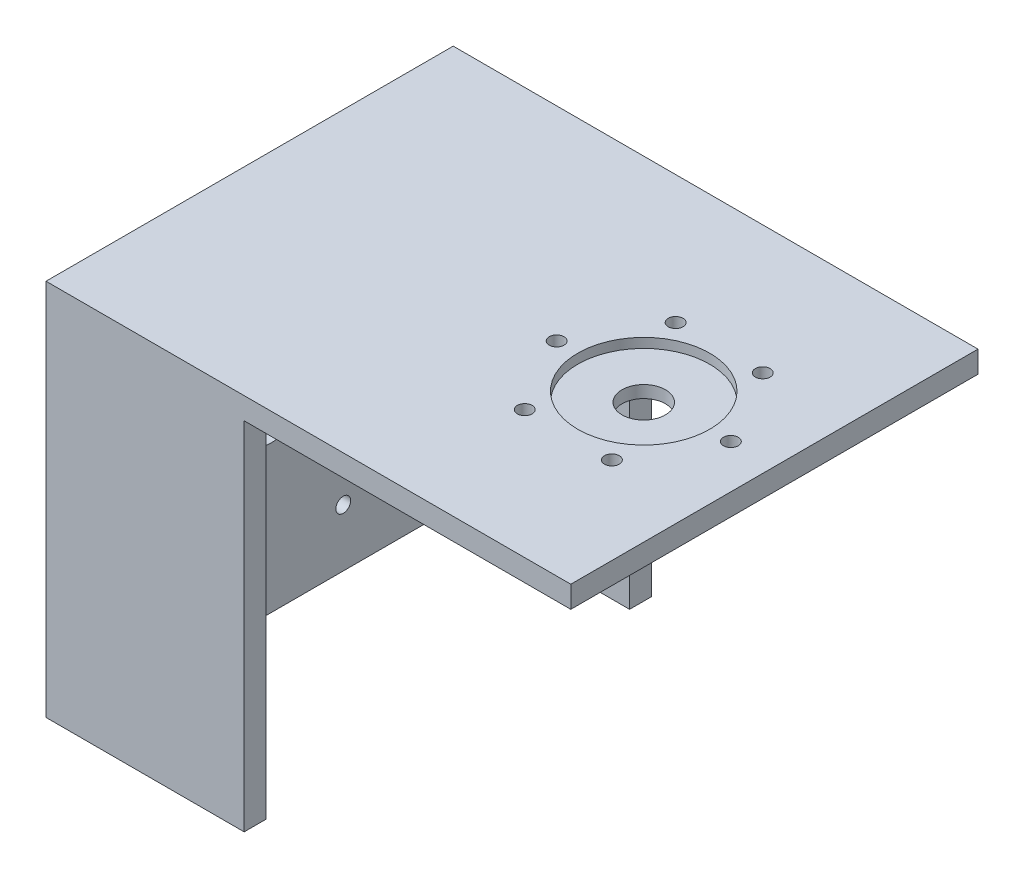
from build123d import *

# Parameters (mm, degrees)
SK_OUTPUT_PLATE_W        = 120.5
SK_OUTPUT_PLATE_H        = 93.5
SK_OUTPUT_PLATE_R        = 1.7
SK_OUTPUT_PLATE_R_2      = 5
OUTPUT_PLATE_DEPTH       = 5
SK_PITCH_PILOT_RECESS_R  = 15.15
PITCH_PILOT_RECESS_DEPTH = 2.2
SK_REAR_PLATE_W          = 93.5
SK_REAR_PLATE_H          = 86.75
SK_REAR_PLATE_R          = 8
SK_REAR_PLATE_R_2        = 1.7
REAR_PLATE_DEPTH         = 5
SK_TOP_PLATE_W           = 45.5
SK_TOP_PLATE_H           = 86.75
TOP_PLATE_DEPTH          = 5
SK_BOTTOM_PLATE_W        = 45.5
SK_BOTTOM_PLATE_H        = 86.75
BOTTOM_PLATE_DEPTH       = 5


with BuildPart() as part:
    # SK_Output_Plate → Output_Plate (new body)
    with BuildSketch(Plane(origin=(0, -5, 0), x_dir=(1, 0, 0), z_dir=(0, 1, 0))):
        with Locations((-30.25, 0)):
            Rectangle(SK_OUTPUT_PLATE_W, SK_OUTPUT_PLATE_H)
        with Locations(Location((20, 0, 0), (0, 0, 270))):
            Circle(SK_OUTPUT_PLATE_R, mode=Mode.SUBTRACT)
        with Locations(Location((10, 17.320508076, 0), (0, 0, 270))):
            Circle(SK_OUTPUT_PLATE_R, mode=Mode.SUBTRACT)
        with Locations(Location((-10, 17.320508076, 0), (0, 0, 270))):
            Circle(SK_OUTPUT_PLATE_R, mode=Mode.SUBTRACT)
        with Locations(Location((-20, 0, 0), (0, 0, 270))):
            Circle(SK_OUTPUT_PLATE_R, mode=Mode.SUBTRACT)
        with Locations(Location((-10, -17.320508076, 0), (0, 0, 270))):
            Circle(SK_OUTPUT_PLATE_R, mode=Mode.SUBTRACT)
        with Locations(Location((10, -17.320508076, 0), (0, 0, 270))):
            Circle(SK_OUTPUT_PLATE_R, mode=Mode.SUBTRACT)
        with Locations(Location((0, 0, 0), (0, 0, 270))):
            Circle(SK_OUTPUT_PLATE_R_2, mode=Mode.SUBTRACT)
    extrude(amount=OUTPUT_PLATE_DEPTH)

    # SK_Pitch_Pilot_Recess → Pitch_Pilot_Recess (cut)
    with BuildSketch(Plane(origin=(0, 0, 0), x_dir=(1, 0, 0), z_dir=(0, 1, 0))):
        with Locations(Location((0, 0, 0), (0, 0, 270))):
            Circle(SK_PITCH_PILOT_RECESS_R)
    extrude(amount=-PITCH_PILOT_RECESS_DEPTH, mode=Mode.SUBTRACT)

    # SK_Rear_Plate → Rear_Plate (add)
    with BuildSketch(Plane(origin=(-90.5, 0, 0), x_dir=(0, 0, -1), z_dir=(1, 0, 0))):
        with Locations((0, -43.375)):
            Rectangle(SK_REAR_PLATE_W, SK_REAR_PLATE_H)
        with Locations((0, -45)):
            Circle(SK_REAR_PLATE_R, mode=Mode.SUBTRACT)
        with Locations((33, -45)):
            Circle(SK_REAR_PLATE_R_2, mode=Mode.SUBTRACT)
        with Locations((16.5, -73.578838325)):
            Circle(SK_REAR_PLATE_R_2, mode=Mode.SUBTRACT)
        with Locations((-16.5, -73.578838325)):
            Circle(SK_REAR_PLATE_R_2, mode=Mode.SUBTRACT)
        with Locations((-33, -45)):
            Circle(SK_REAR_PLATE_R_2, mode=Mode.SUBTRACT)
        with Locations((-16.5, -16.421161675)):
            Circle(SK_REAR_PLATE_R_2, mode=Mode.SUBTRACT)
        with Locations((16.5, -16.421161675)):
            Circle(SK_REAR_PLATE_R_2, mode=Mode.SUBTRACT)
    extrude(amount=REAR_PLATE_DEPTH)

    # SK_Top_Plate → Top_Plate (add)
    with BuildSketch(Plane.XY.offset(41.75)):
        with Locations((-67.75, -43.375)):
            Rectangle(SK_TOP_PLATE_W, SK_TOP_PLATE_H)
    extrude(amount=TOP_PLATE_DEPTH)

    # SK_Bottom_Plate → Bottom_Plate (add)
    with BuildSketch(Plane.XY.offset(-46.75)):
        with Locations((-67.75, -43.375)):
            Rectangle(SK_BOTTOM_PLATE_W, SK_BOTTOM_PLATE_H)
    extrude(amount=BOTTOM_PLATE_DEPTH)


solid = part.part
